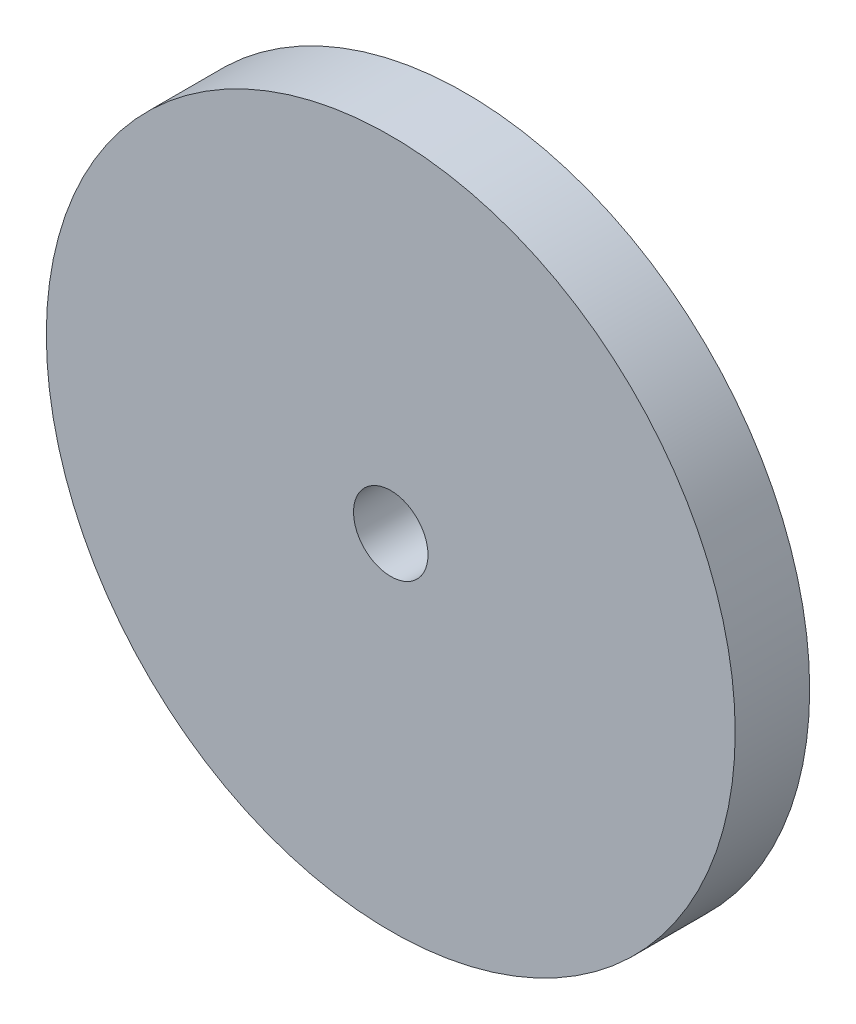
from build123d import *

# Parameters (mm, degrees)
SKETCH2_R           = 18.5
BOSS_EXTRUDE1_DEPTH = 4
SKETCH3_R           = 2
CUT_EXTRUDE1_DEPTH  = 4


with BuildPart() as part:
    # Sketch2 → Boss-Extrude1 (new body)
    with BuildSketch(Plane.XY):
        Circle(SKETCH2_R)
    extrude(amount=BOSS_EXTRUDE1_DEPTH)

    # Sketch3 → Cut-Extrude1 (cut)
    with BuildSketch(Plane.XY.offset(4)):
        Circle(SKETCH3_R)
    extrude(amount=-CUT_EXTRUDE1_DEPTH, mode=Mode.SUBTRACT)


solid = part.part
